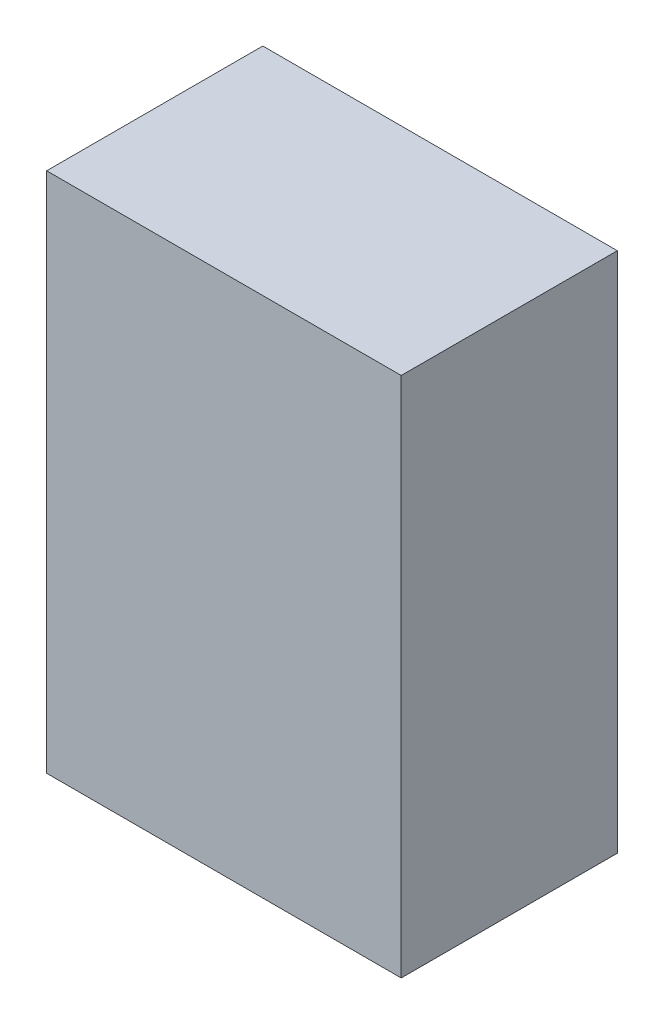
from build123d import *

# Parameters (mm, degrees)
SKETCH1_W           = 82.026523297
SKETCH1_H           = 120.71827957
BOSS_EXTRUDE2_DEPTH = 50


with BuildPart() as part:
    # Sketch1 → Boss-Extrude2 (new body)
    with BuildSketch(Plane.XY):
        with Locations((-33.077582437, -5.029928315)):
            Rectangle(SKETCH1_W, SKETCH1_H)
    extrude(amount=BOSS_EXTRUDE2_DEPTH)


solid = part.part
